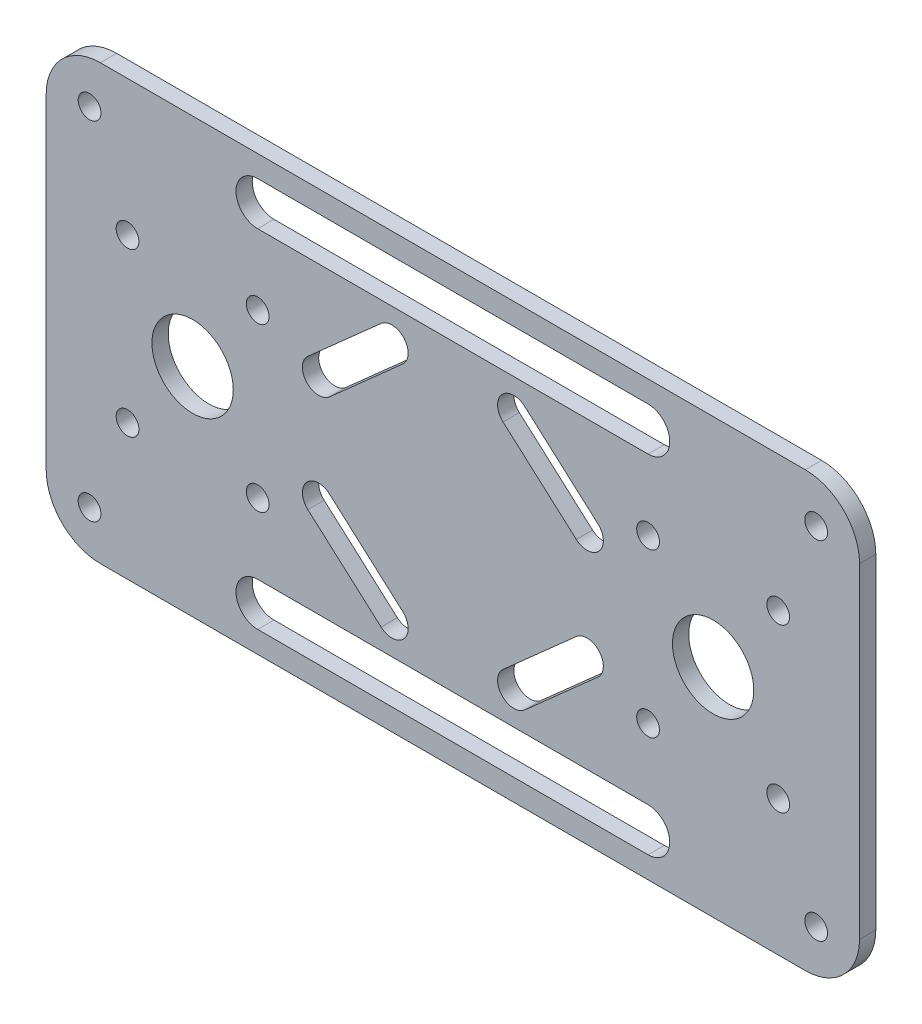
from build123d import *

# Parameters (mm, degrees)
SKETCH_1_R          = 2.1
EXTRUDE_1_DEPTH     = 3
SKETCH_2_R          = 2.1
CUT_EXTRUDE_1_DEPTH = 3
SKETCH_3_R          = 7.5
CUT_EXTRUDE_2_DEPTH = 3


with BuildPart() as part:
    # 草图1 → 凸台-拉伸1 (new body)
    with BuildSketch(Plane.XY):
        with BuildLine():
            Line((10, 0), (140, 0))
            ThreePointArc((140, 0), (147.071067812, -2.928932188), (150, -10))
            Line((150, -10), (150, -70))
            ThreePointArc((150, -70), (147.071067812, -77.071067812), (140, -80))
            Line((140, -80), (10, -80))
            ThreePointArc((10, -80), (2.928932188, -77.071067812), (0, -70))
            Line((0, -70), (0, -10))
            ThreePointArc((0, -10), (2.928932188, -2.928932188), (10, 0))
        make_face()
        with Locations((8, -8)):
            Circle(SKETCH_1_R, mode=Mode.SUBTRACT)
        with Locations((8, -72)):
            Circle(SKETCH_1_R, mode=Mode.SUBTRACT)
        with Locations((142, -72)):
            Circle(SKETCH_1_R, mode=Mode.SUBTRACT)
        with Locations((142, -8)):
            Circle(SKETCH_1_R, mode=Mode.SUBTRACT)
    extrude(amount=EXTRUDE_1_DEPTH)

    # 草图2 → 切除-拉伸1 (cut)
    with BuildSketch(Plane.XY.offset(3)):
        with Locations((15, -25)):
            Circle(SKETCH_2_R)
        with Locations((39, -25)):
            Circle(SKETCH_2_R)
        with Locations((39, -55)):
            Circle(SKETCH_2_R)
        with Locations((15, -55)):
            Circle(SKETCH_2_R)
        with Locations(Location((111, -55, 0), (0, 0, 180))):
            Circle(SKETCH_2_R)
        with Locations(Location((111, -25, 0), (0, 0, 180))):
            Circle(SKETCH_2_R)
        with Locations(Location((135, -25, 0), (0, 0, 180))):
            Circle(SKETCH_2_R)
        with Locations(Location((135, -55, 0), (0, 0, 180))):
            Circle(SKETCH_2_R)
    extrude(amount=-CUT_EXTRUDE_1_DEPTH, mode=Mode.SUBTRACT)

    # 草图3 → 切除-拉伸2 (cut)
    with BuildSketch(Plane.XY.offset(3)):
        with Locations((27, -40)):
            Circle(SKETCH_3_R)
        with Locations(Location((123, -40, 0), (0, 0, 180))):
            Circle(SKETCH_3_R)
        with BuildLine():
            Line((39, -4), (111, -4))
            ThreePointArc((111, -4), (115, -8), (111, -12))
            Line((111, -12), (39, -12))
            ThreePointArc((39, -12), (35, -8), (39, -4))
        make_face()
        with BuildLine():
            Line((39, -76), (111, -76))
            ThreePointArc((111, -76), (115, -72), (111, -68))
            Line((111, -68), (39, -68))
            ThreePointArc((39, -68), (35, -72), (39, -76))
        make_face()
        with BuildLine():
            Line((65.743091516, -20.242227956), (52.243091516, -32.242227956))
            ThreePointArc((52.243091516, -32.242227956), (48.007772044, -31.993091516), (48.256908484, -27.757772044))
            Line((48.256908484, -27.757772044), (61.756908484, -15.757772044))
            ThreePointArc((61.756908484, -15.757772044), (65.992227956, -16.006908484), (65.743091516, -20.242227956))
        make_face()
        with BuildLine():
            Line((65.743091516, -59.757772044), (52.243091516, -47.757772044))
            ThreePointArc((52.243091516, -47.757772044), (48.007772044, -48.006908484), (48.256908484, -52.242227956))
            Line((48.256908484, -52.242227956), (61.756908484, -64.242227956))
            ThreePointArc((61.756908484, -64.242227956), (65.992227956, -63.993091516), (65.743091516, -59.757772044))
        make_face()
        with BuildLine():
            Line((84.256908484, -20.242227956), (97.756908484, -32.242227956))
            ThreePointArc((97.756908484, -32.242227956), (101.992227956, -31.993091516), (101.743091516, -27.757772044))
            Line((101.743091516, -27.757772044), (88.243091516, -15.757772044))
            ThreePointArc((88.243091516, -15.757772044), (84.007772044, -16.006908484), (84.256908484, -20.242227956))
        make_face()
        with BuildLine():
            Line((84.256908484, -59.757772044), (97.756908484, -47.757772044))
            ThreePointArc((97.756908484, -47.757772044), (101.992227956, -48.006908484), (101.743091516, -52.242227956))
            Line((101.743091516, -52.242227956), (88.243091516, -64.242227956))
            ThreePointArc((88.243091516, -64.242227956), (84.007772044, -63.993091516), (84.256908484, -59.757772044))
        make_face()
    extrude(amount=-CUT_EXTRUDE_2_DEPTH, mode=Mode.SUBTRACT)


solid = part.part
